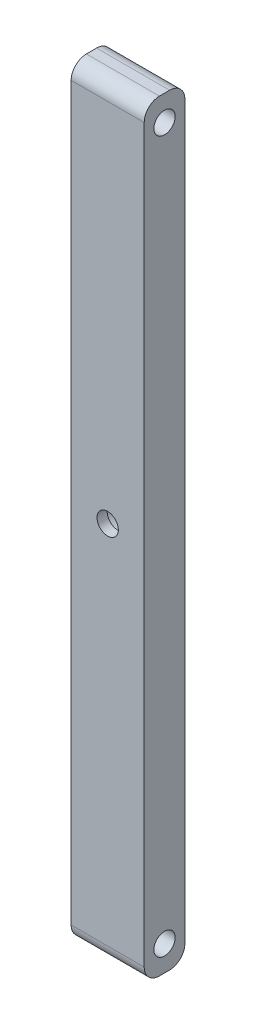
from build123d import *

# Parameters (mm, degrees)
CROQUIS1_W              = 14.382940013
CROQUIS1_H              = 150
CROQUIS1_W_2            = 10
CROQUIS1_H_2            = 20
CROQUIS1_R              = 3.1
CROQUIS1_R_2            = 2.1
SALIENTE_EXTRUIR1_DEPTH = 2
CROQUIS2_W              = 14.382940013
CROQUIS2_H              = 150
CROQUIS2_R              = 4
SALIENTE_EXTRUIR2_DEPTH = 6
CROQUIS3_R              = 3.1
CORTAR_EXTRUIR1_DEPTH   = 4
CROQUIS4_R              = 2.1
CORTAR_EXTRUIR2_DEPTH   = 278.82310565
REDONDEO2_R             = 3


with BuildPart() as part:
    # Croquis1 → Saliente-Extruir1 (new body)
    # profile 1 of 3: a face of its own
    with BuildSketch(Plane(origin=(0, 0, -134.198862982), x_dir=(-1, 0, 0), z_dir=(0, 0, -1))):
        with Locations((-52.715326076, 163.447805519)):
            Rectangle(CROQUIS1_W, CROQUIS1_H)
        with Locations((-52.715326075, 163.447805519)):
            Rectangle(CROQUIS1_W_2, CROQUIS1_H_2, mode=Mode.SUBTRACT)
    # profile 2 of 3: a face of its own
    with BuildSketch(Plane(origin=(0, 0, -134.198862982), x_dir=(-1, 0, 0), z_dir=(0, 0, -1))):
        with Locations((-52.715326075, 163.447805519)):
            Rectangle(CROQUIS1_W_2, CROQUIS1_H_2)
        with Locations((-52.715326075, 163.447805519)):
            Circle(CROQUIS1_R, mode=Mode.SUBTRACT)
    # profile 3 of 3: a face of its own
    with BuildSketch(Plane(origin=(0, 0, -134.198862982), x_dir=(-1, 0, 0), z_dir=(0, 0, -1))):
        with Locations((-52.715326075, 163.447805519)):
            Circle(CROQUIS1_R)
        with Locations((-52.715326075, 163.447805519)):
            Circle(CROQUIS1_R_2, mode=Mode.SUBTRACT)
    extrude(amount=SALIENTE_EXTRUIR1_DEPTH)

    # Croquis2 → Saliente-Extruir2 (add)
    with BuildSketch(Plane(origin=(0, 0, -136.198862982), x_dir=(-1, 0, 0), z_dir=(0, 0, -1))):
        with Locations((-52.715326076, 163.447805519)):
            Rectangle(CROQUIS2_W, CROQUIS2_H)
        with Locations((-52.715326075, 163.447805519)):
            Circle(CROQUIS2_R, mode=Mode.SUBTRACT)
    extrude(amount=SALIENTE_EXTRUIR2_DEPTH)

    # Croquis3 → Cortar-Extruir1 (cut)
    with BuildSketch(Plane.ZY.offset(-45.523856069)):
        with Locations((-138.198862982, 93.447805519)):
            Circle(CROQUIS3_R)
        with Locations((-138.198862982, 233.447805519)):
            Circle(CROQUIS3_R)
    extrude(amount=-CORTAR_EXTRUIR1_DEPTH, mode=Mode.SUBTRACT)

    # Croquis4 → Cortar-Extruir2 (cut, through all)
    with BuildSketch(Plane.ZY.offset(-49.523856069)):
        with Locations((-138.198862982, 233.447805519)):
            Circle(CROQUIS4_R)
        with Locations((-138.198862982, 93.447805519)):
            Circle(CROQUIS4_R)
    extrude(amount=-CORTAR_EXTRUIR2_DEPTH, mode=Mode.SUBTRACT)

    # Redondeo2
    redondeo2_edges = [part.edges().sort_by_distance(p)[0] for p in [
        (52.715326075, 88.447805519, -142.198862982),
        (52.715326075, 238.447805519, -142.198862982),
        (52.715326075, 238.447805519, -134.198862982),
        (52.715326075, 88.447805519, -134.198862982),
    ]]
    fillet(redondeo2_edges, radius=REDONDEO2_R)


solid = part.part
